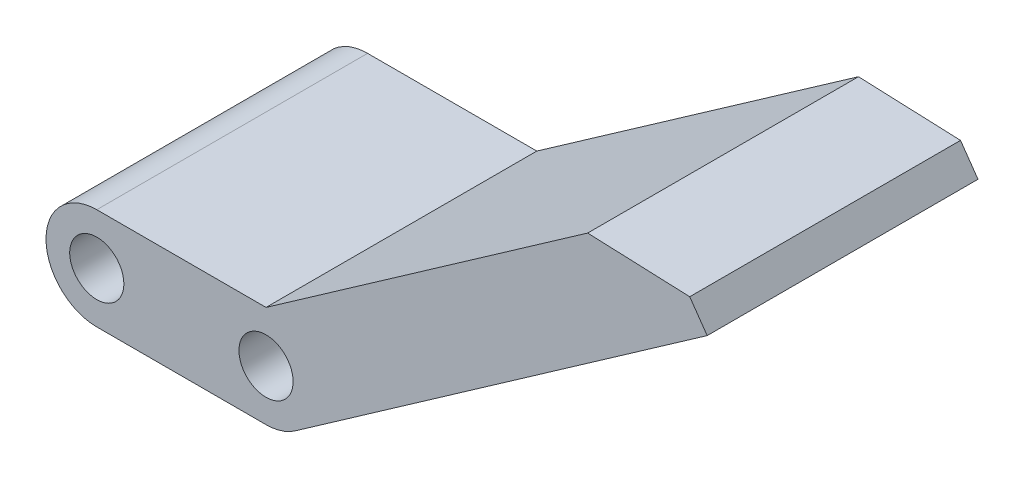
from build123d import *

# Parameters (mm, degrees)
SKETCH2_R           = 4
BOSS_EXTRUDE1_DEPTH = 40


with BuildPart() as part:
    # Sketch2 → Boss-Extrude1 (new body)
    with BuildSketch(Plane.XY):
        with BuildLine():
            Line((25, 7.5), (0, 7.5))
            ThreePointArc((0, 7.5), (-7.5, 0), (0, -7.5))
            Line((0, -7.5), (25, -7.5))
            ThreePointArc((25, -7.5), (27.255293496, -7.152877131), (29.301823273, -6.143640332))
            Line((29.301823273, -6.143640332), (90.166313701, 36.474134675))
            Line((90.166313701, 36.474134675), (87.585219737, 40.160318874))
            Line((87.585219737, 40.160318874), (72.510818569, 40.767433308))
            Line((72.510818569, 40.767433308), (25, 7.5))
        make_face()
        Circle(SKETCH2_R, mode=Mode.SUBTRACT)
        with Locations((25, 0)):
            Circle(SKETCH2_R, mode=Mode.SUBTRACT)
    extrude(amount=BOSS_EXTRUDE1_DEPTH)


solid = part.part
